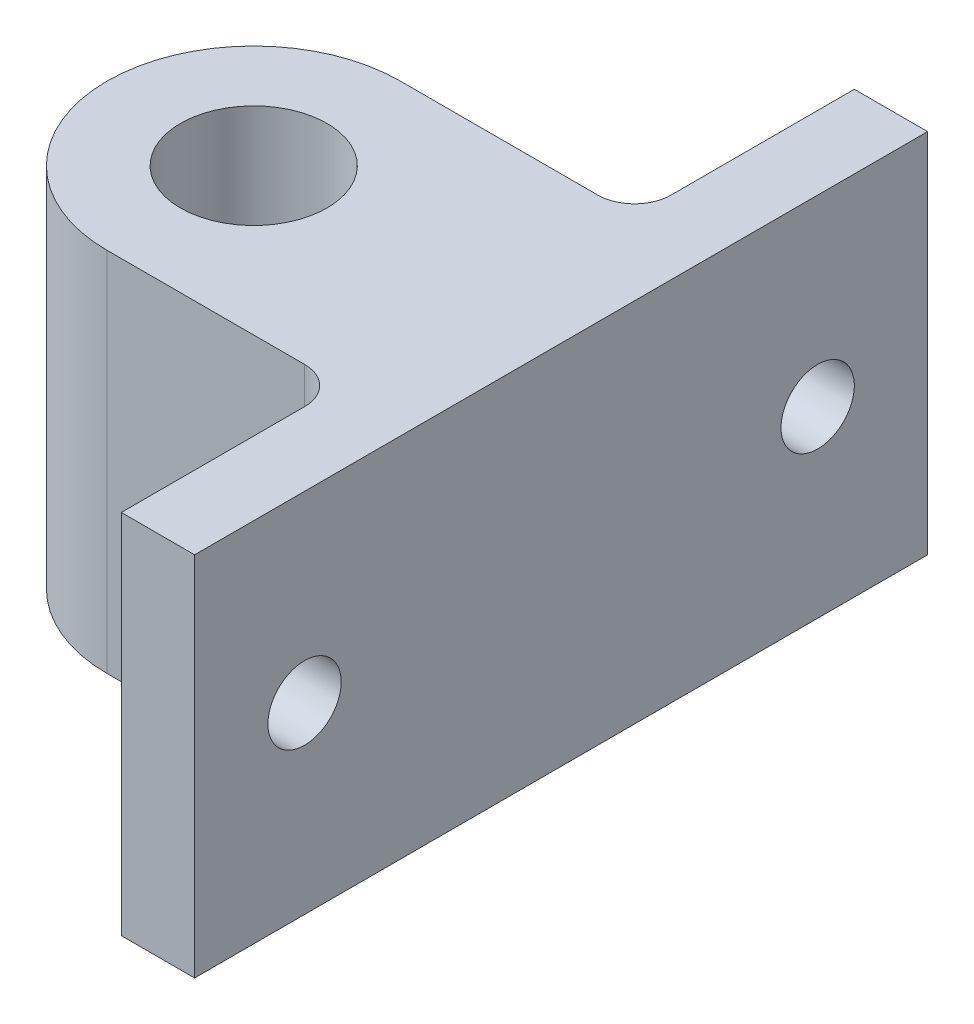
from build123d import *

# Parameters (mm, degrees)
SKETCH1_R           = 4
BOSS_EXTRUDE1_DEPTH = 20
SKETCH2_R           = 2
CUT_EXTRUDE1_DEPTH  = 20
FILLET1_R           = 2


with BuildPart() as part:
    # Sketch1 → Boss-Extrude1 (new body)
    with BuildSketch(Plane(origin=(0, 0, 0), x_dir=(1, 0, 0), z_dir=(0, 1, 0))):
        with BuildLine():
            Line((-14.775, 8), (-2, 8))
            Line((-2, 8), (-2, 20))
            Line((-2, 20), (2, 20))
            Line((2, 20), (2, -20))
            Line((2, -20), (-2, -20))
            Line((-2, -20), (-2, -8))
            Line((-2, -8), (-14.775, -8))
            ThreePointArc((-14.775, -8), (-22.775, 0), (-14.775, 8))
        make_face()
        with Locations(Location((-14.775, 0, 0), (0, 0, 270))):
            Circle(SKETCH1_R, mode=Mode.SUBTRACT)
    extrude(amount=BOSS_EXTRUDE1_DEPTH)

    # Sketch2 → Cut-Extrude1 (cut)
    with BuildSketch(Plane.ZY.offset(2)):
        with Locations((-14, 10)):
            Circle(SKETCH2_R)
        with Locations((14, 10)):
            Circle(SKETCH2_R)
    extrude(amount=-CUT_EXTRUDE1_DEPTH, mode=Mode.SUBTRACT)

    # Fillet1
    fillet1_edges = [part.edges().sort_by_distance(p)[0] for p in [
        (-2, 10, 8),
        (-2, 10, -8),
    ]]
    fillet(fillet1_edges, radius=FILLET1_R)


solid = part.part
